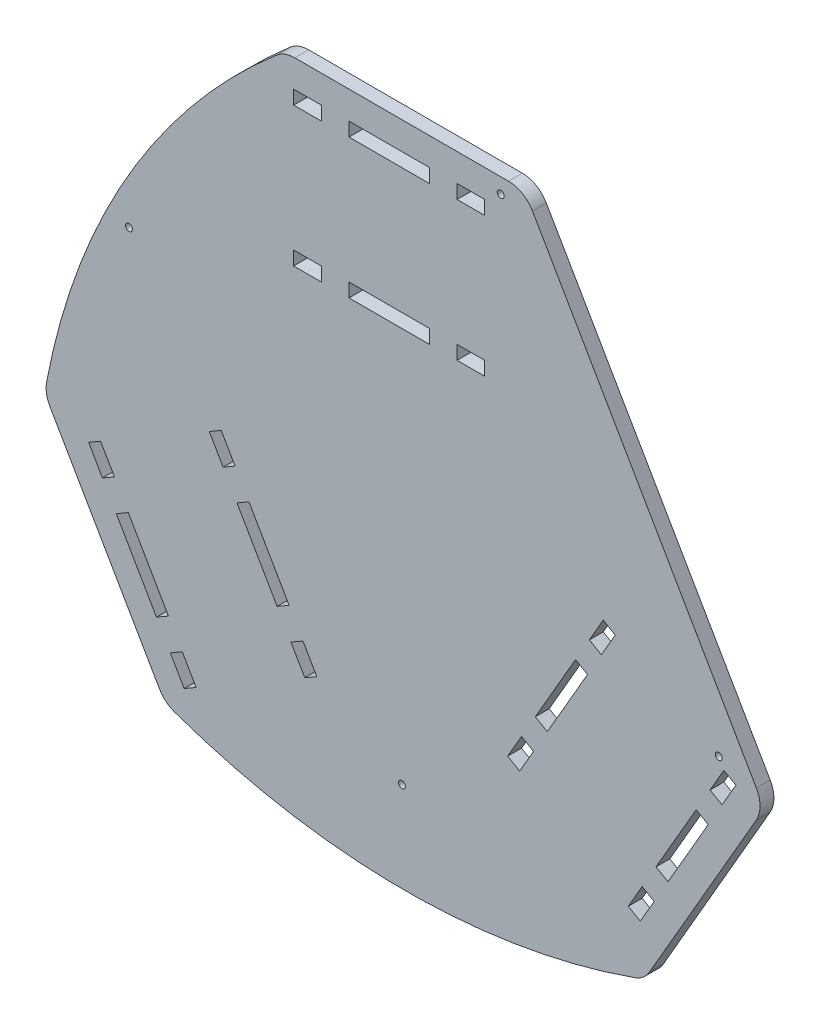
from build123d import *

# Parameters (mm, degrees)
BOSS_EXTRUDE1_DEPTH = 5
BOSS_EXTRUDE2_DEPTH = 5
SKETCH4_W           = 10
SKETCH4_H           = 5
SKETCH4_W_2         = 29
CUT_EXTRUDE2_DEPTH  = 5
BOSS_EXTRUDE3_DEPTH = 5
SKETCH7_R           = 1.25
CUT_EXTRUDE4_DEPTH  = 5
FILLET2_R           = 10


with BuildPart() as part:
    # Sketch1 → Boss-Extrude1 (new body)
    with BuildSketch(Plane(origin=(0, 0, 0), x_dir=(0.8660254037844434, -0.49999999999999206, 0), z_dir=(0, 0, 1))):
        Polygon((125, -43.301270189), (125, 43.301270189), (-25, 129.903810568), (-100, 86.602540378), (-100, -86.602540378), (-25, -129.903810568), align=None)
    extrude(amount=BOSS_EXTRUDE1_DEPTH)

    # Sketch3 → Boss-Extrude2 (add)
    with BuildSketch(Plane.XY.offset(5)):
        Polygon((-86.602540378, -100), (86.602540378, -100), (129.903810568, -25), (43.301270189, 125), (-43.301270189, 125), (-129.903810568, -25), align=None)
    extrude(amount=-BOSS_EXTRUDE2_DEPTH)

    # Sketch4 → Cut-Extrude2 (cut)
    with BuildSketch(Plane.XY.offset(5)):
        with Locations((-35.05, 112.5)):
            Rectangle(SKETCH4_W, SKETCH4_H)
        with Locations((23.95, 112.5)):
            Rectangle(SKETCH4_W, SKETCH4_H)
        with Locations((-5.55, 112.5)):
            Rectangle(SKETCH4_W_2, SKETCH4_H)
        with Locations((-35.05, 62.1999492)):
            Rectangle(SKETCH4_W, SKETCH4_H)
        with Locations((23.95, 62.1999492)):
            Rectangle(SKETCH4_W, SKETCH4_H)
        with Locations((-5.55, 62.1999492)):
            Rectangle(SKETCH4_W_2, SKETCH4_H)
        Polygon((115.287794416, -20.315682578), (110.287794416, -28.975936616), (114.617921435, -31.475936616), (119.617921435, -22.815682578), align=None)
        Polygon((80.787794416, -80.07143544), (85.117921435, -82.57143544), (90.117921435, -73.911181402), (85.787794416, -71.411181402), align=None)
        Polygon((109.617921435, -40.136190654), (105.287794416, -37.636190654), (90.787794416, -62.750927364), (95.117921435, -65.250927364), align=None)
        Polygon((71.726672612, 4.834342822), (66.726672612, -3.825911216), (71.056799631, -6.325911216), (76.056799631, 2.334342822), align=None)
        Polygon((37.226672612, -54.92141004), (41.556799631, -57.42141004), (46.556799631, -48.761156002), (42.226672612, -46.261156002), align=None)
        Polygon((66.056799631, -14.986165254), (61.726672612, -12.486165254), (47.226672612, -37.600901964), (51.556799631, -40.100901964), align=None)
        Polygon((-75.237794416, -89.684317422), (-80.237794416, -81.024063384), (-84.567921435, -83.524063384), (-79.567921435, -92.184317422), align=None)
        Polygon((-109.737794416, -29.92856456), (-114.067921435, -32.42856456), (-109.067921435, -41.088818598), (-104.737794416, -38.588818598), align=None)
        Polygon((-89.567921435, -74.863809346), (-85.237794416, -72.363809346), (-99.737794416, -47.249072636), (-104.067921435, -49.749072636), align=None)
        Polygon((-31.676672612, -64.534292022), (-36.676672612, -55.874037984), (-41.006799631, -58.374037984), (-36.006799631, -67.034292022), align=None)
        Polygon((-66.176672612, -4.77853916), (-70.506799631, -7.27853916), (-65.506799631, -15.938793198), (-61.176672612, -13.438793198), align=None)
        Polygon((-46.006799631, -49.713783946), (-41.676672612, -47.213783946), (-56.176672612, -22.099047236), (-60.506799631, -24.599047236), align=None)
    extrude(amount=-CUT_EXTRUDE2_DEPTH, mode=Mode.SUBTRACT)

    # Sketch5 → Boss-Extrude3 (add)
    with BuildSketch(Plane.XY.offset(5)):
        with BuildLine():
            ThreePointArc((-43.301270189, 125), (-100.007931209, 57.739606004), (-129.903810568, -25))
            Line((-129.903810568, -25), (-43.301270189, 125))
        make_face()
        with BuildLine():
            ThreePointArc((-86.602540378, -100), (0, -115.479212009), (86.602540378, -100))
            Line((86.602540378, -100), (-86.602540378, -100))
        make_face()
    extrude(amount=-BOSS_EXTRUDE3_DEPTH)

    # Sketch7 → Cut-Extrude4 (cut)
    with BuildSketch(Plane.XY.offset(5)):
        with Locations((-99.474904421, 42.045588536)):
            Circle(SKETCH7_R)
        with Locations((34.707071641, 119.515588536)):
            Circle(SKETCH7_R)
        with Locations((113.447071641, -16.866092052)):
            Circle(SKETCH7_R)
        with Locations((-0.937563691, -82.906092052)):
            Circle(SKETCH7_R)
    extrude(amount=-CUT_EXTRUDE4_DEPTH, mode=Mode.SUBTRACT)

    # Fillet2
    fillet2_edges = [part.edges().sort_by_distance(p)[0] for p in [
        (129.903810568, -25, 2.5),
        (86.602540378, -100, 2.5),
        (-86.602540378, -100, 2.5),
        (-129.903810568, -25, 2.5),
        (-43.301270189, 125, 2.5),
        (43.301270189, 125, 2.5),
    ]]
    fillet(fillet2_edges, radius=FILLET2_R)


solid = part.part
